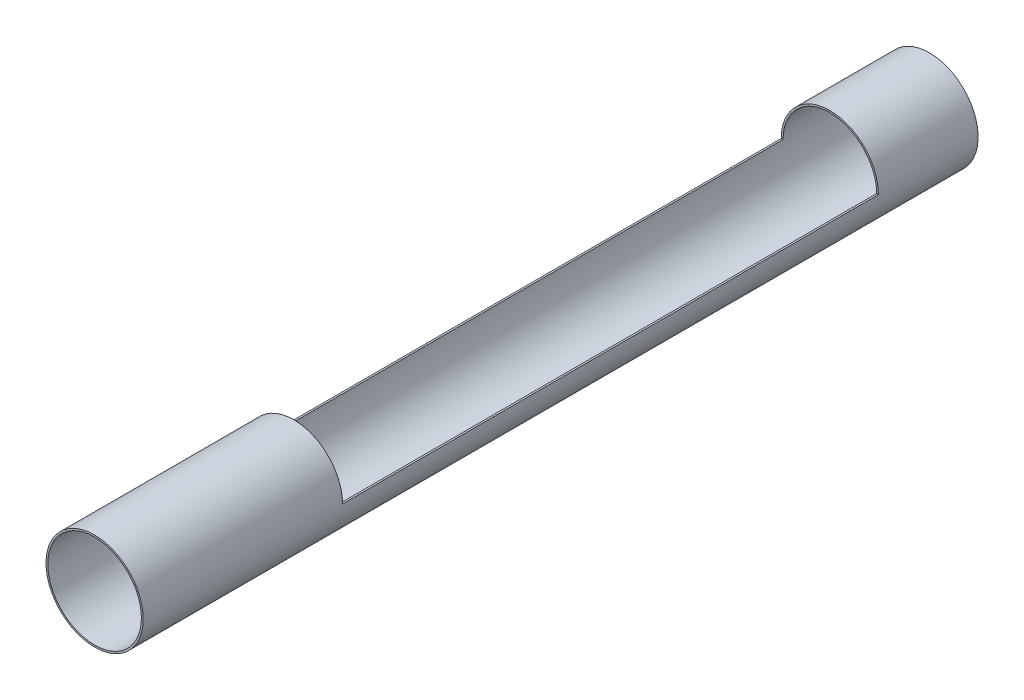
from build123d import *

# Parameters (mm, degrees)
BOSS_EXTRUDE1_DEPTH = 546.1
SKETCH2_R           = 49.5046
SKETCH2_R_2         = 47.6885
BOSS_EXTRUDE2_DEPTH = 203.2
BOSS_EXTRUDE3_START = 101.6
SKETCH3_R           = 49.5046
SKETCH3_R_2         = 47.6885
BOSS_EXTRUDE3_DEPTH = 101.6


with BuildPart() as part:
    # Sketch1 → Boss-Extrude1 (new body)
    with BuildSketch(Plane.XY):
        with BuildLine():
            Line((-49.5046, 0), (-47.6885, 0))
            ThreePointArc((-47.6885, 0), (0, -47.6885), (47.6885, 0))
            Line((47.6885, 0), (49.5046, 0))
            ThreePointArc((49.5046, 0), (0, -49.5046), (-49.5046, 0))
        make_face()
    extrude(amount=BOSS_EXTRUDE1_DEPTH)

    # Sketch2 → Boss-Extrude2 (add)
    with BuildSketch(Plane.XY.offset(546.1)):
        Circle(SKETCH2_R)
        Circle(SKETCH2_R_2, mode=Mode.SUBTRACT)
    extrude(amount=BOSS_EXTRUDE2_DEPTH)

    # Sketch3 → Boss-Extrude3 (add)
    with BuildSketch(Plane(origin=(0, 0, 0), x_dir=(-1, 0, 0), z_dir=(0, 0, -1)).offset(BOSS_EXTRUDE3_START)):
        Circle(SKETCH3_R)
        Circle(SKETCH3_R_2, mode=Mode.SUBTRACT)
    extrude(amount=-BOSS_EXTRUDE3_DEPTH)


solid = part.part
